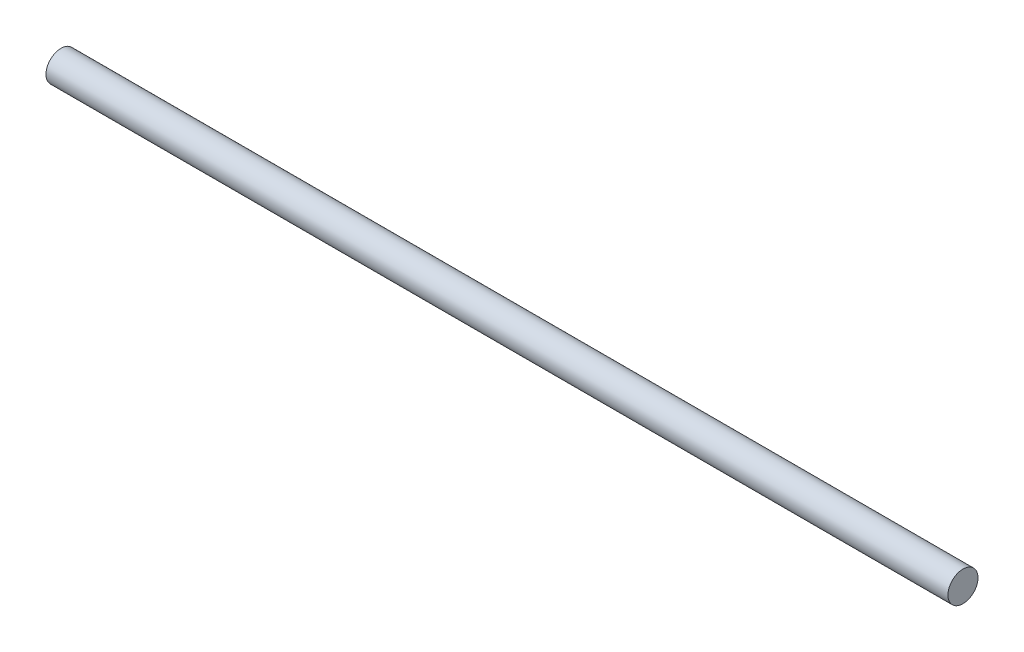
from build123d import *

# Parameters (mm, degrees)
SKETCH1_R           = 1.25
BOSS_EXTRUDE1_DEPTH = 75


with BuildPart() as part:
    # Sketch1 → Boss-Extrude1 (new body)
    with BuildSketch(Plane(origin=(0, 0, 0), x_dir=(0, 0, -1), z_dir=(1, 0, 0))):
        Circle(SKETCH1_R)
    extrude(amount=BOSS_EXTRUDE1_DEPTH)


solid = part.part
